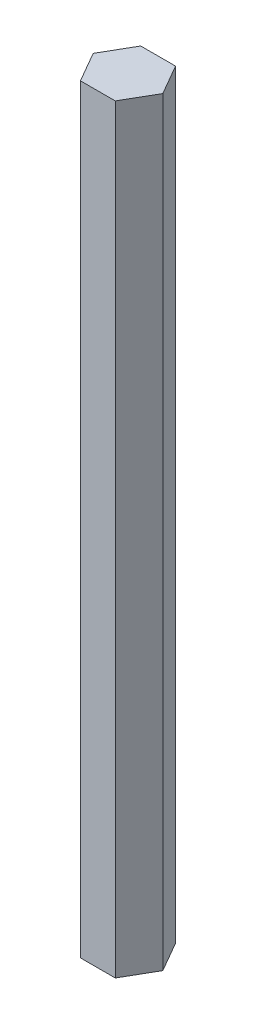
from build123d import *

# Parameters (mm, degrees)
SALIENTE_EXTRUIR1_DEPTH = 160


with BuildPart() as part:
    # Croquis1 → Saliente-Extruir1 (new body)
    with BuildSketch(Plane(origin=(0, 0, 0), x_dir=(1, 0, 0), z_dir=(0, 1, 0))):
        Polygon((7.332348419, 0), (3.666174209, 6.35), (-3.666174209, 6.35), (-7.332348419, 0), (-3.666174209, -6.35), (3.666174209, -6.35), align=None)
    extrude(amount=SALIENTE_EXTRUIR1_DEPTH)


solid = part.part
